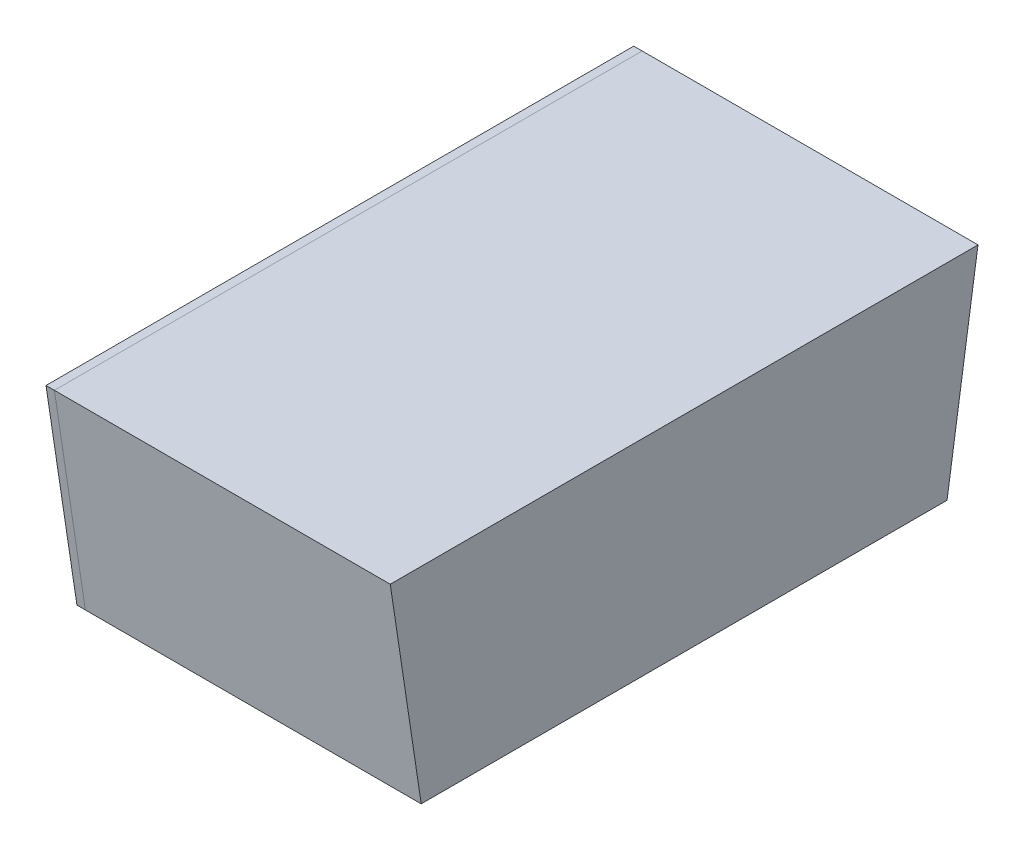
from build123d import *

# Parameters (mm, degrees)
BOSS_EXTRUDE1_DEPTH = 254
BOSS_EXTRUDE2_DEPTH = 6.35


with BuildPart() as part:
    # Sketch1 → Boss-Extrude1 (new body)
    with BuildSketch(Plane(origin=(0, 0, 0), x_dir=(0, 0, -1), z_dir=(1, 0, 0))):
        Polygon((0, 161.91), (-23.4, 317.48), (421.1, 317.48), (397.7, 161.91), align=None)
    extrude(amount=BOSS_EXTRUDE1_DEPTH)


with BuildPart() as body_2:
    # Sketch5 → Boss-Extrude2 (new body)
    with BuildSketch(Plane.ZY):
        Polygon((-397.7, 161.91), (0, 161.91), (23.4, 317.48), (-421.1, 317.48), align=None)
    extrude(amount=BOSS_EXTRUDE2_DEPTH)


solid = Compound([part.part, body_2.part])
